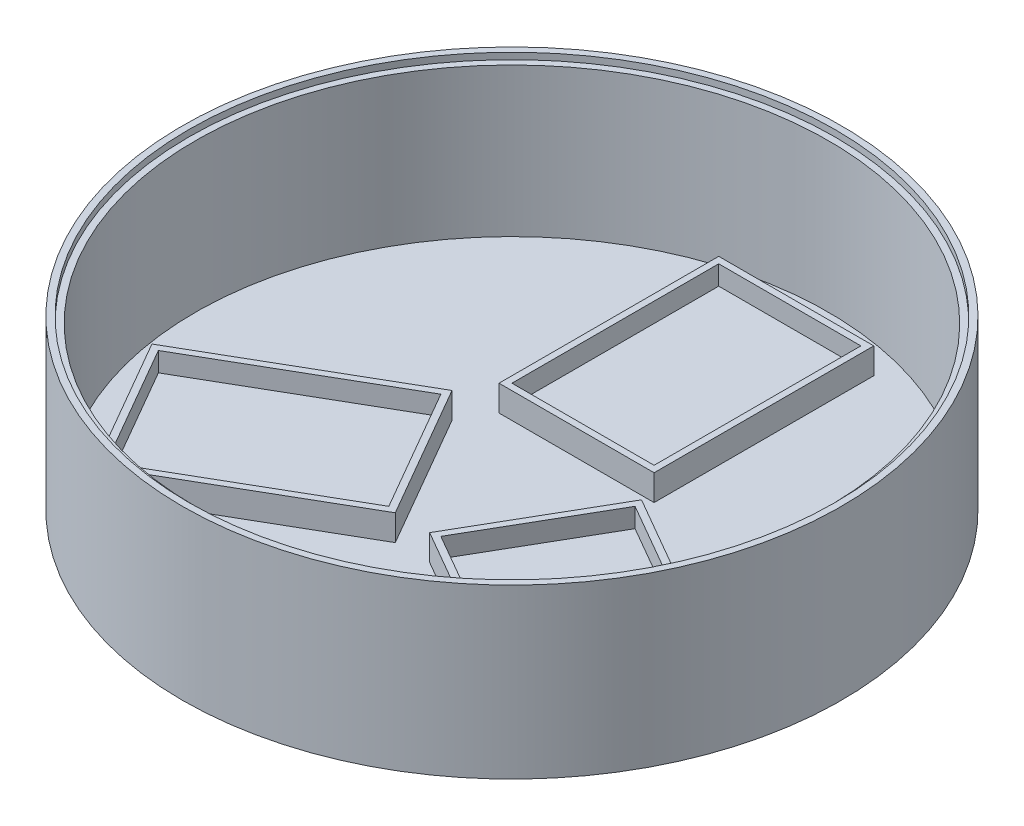
from build123d import *

# Parameters (mm, degrees)
SKETCH1_R           = 255
BOSS_EXTRUDE1_DEPTH = 125
SHELL1_T            = -10
SKETCH3_W           = 120
SKETCH3_H           = 170
BOSS_EXTRUDE3_DEPTH = 20
SKETCH2_R           = 255
SKETCH2_R_2         = 250
BOSS_EXTRUDE2_DEPTH = 5
SKETCH5_W           = 110
SKETCH5_H           = 160
CUT_EXTRUDE1_DEPTH  = 15


with BuildPart() as part:
    # Sketch1 → Boss-Extrude1 (new body)
    with BuildSketch(Plane(origin=(0, 0, 0), x_dir=(1, 0, 0), z_dir=(0, 1, 0))):
        with Locations(Location((0, 0, 0), (0, 0, 270))):
            Circle(SKETCH1_R)
    extrude(amount=BOSS_EXTRUDE1_DEPTH)

    # Shell1
    shell1_openings = [part.faces().sort_by_distance(p)[0] for p in [
        (0, 125, 0),
    ]]
    offset(amount=SHELL1_T, openings=shell1_openings, kind=Kind.INTERSECTION)

    # Sketch3 → Boss-Extrude3 (add)
    with BuildSketch(Plane(origin=(0, 10, 0), x_dir=(1, 0, 0), z_dir=(0, 1, 0))):
        with Locations((0, 135)):
            Rectangle(SKETCH3_W, SKETCH3_H)
        Polygon((73.301270189, 26.961524227), (220.525588833, -58.038475773), (160.525588833, -161.961524227), (13.301270189, -76.961524227), align=None)
        Polygon((-13.301270189, -76.961524227), (-160.525588833, -161.961524227), (-220.525588833, -58.038475773), (-73.301270189, 26.961524227), align=None)
    extrude(amount=BOSS_EXTRUDE3_DEPTH)

    # Sketch2 → Boss-Extrude2 (add)
    with BuildSketch(Plane(origin=(0, 125, 0), x_dir=(1, 0, 0), z_dir=(0, 1, 0))):
        with Locations(Location((0, 0, 0), (0, 0, 270))):
            Circle(SKETCH2_R)
        with Locations(Location((0, 0, 0), (0, 0, 270))):
            Circle(SKETCH2_R_2, mode=Mode.SUBTRACT)
    extrude(amount=BOSS_EXTRUDE2_DEPTH)

    # Sketch5 → Cut-Extrude1 (cut)
    with BuildSketch(Plane(origin=(0, 30, 0), x_dir=(1, 0, 0), z_dir=(0, 1, 0))):
        Polygon((20.131397208, -75.131397208), (158.695461814, -155.131397208), (213.695461814, -59.868602792), (75.131397208, 20.131397208), align=None)
        with Locations((0, 135)):
            Rectangle(SKETCH5_W, SKETCH5_H)
        Polygon((-75.131397208, 20.131397208), (-213.695461814, -59.868602792), (-158.695461814, -155.131397208), (-20.131397208, -75.131397208), align=None)
    extrude(amount=-CUT_EXTRUDE1_DEPTH, mode=Mode.SUBTRACT)


solid = part.part
